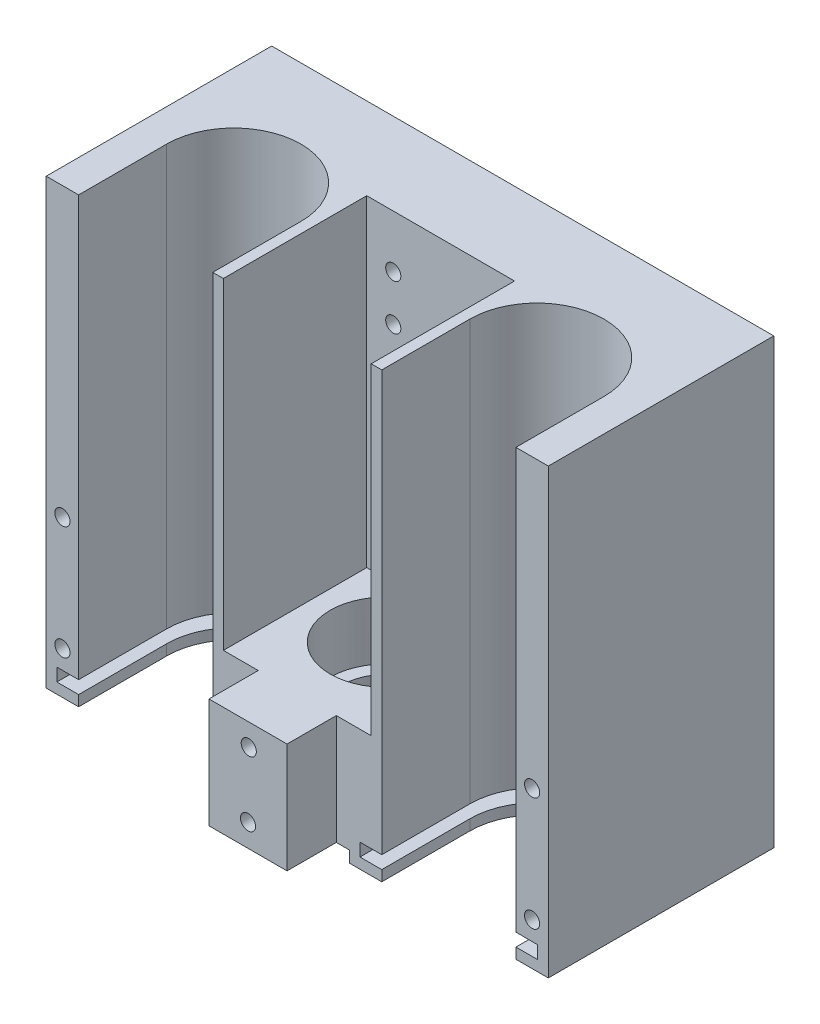
from build123d import *

# Parameters (mm, degrees)
SKETCH1_W                        = 132.5
SKETCH1_H                        = 117
BOSS_EXTRUDE1_DEPTH              = 55.25
CUT_EXTRUDE1_REACH               = 147.364
SKETCH3_W                        = 39
SKETCH3_H                        = 37.83
CUT_EXTRUDE2_DEPTH               = 85
SKETCH4_W                        = 20.6
SKETCH4_H                        = 13
BOSS_EXTRUDE2_DEPTH              = 32
SKETCH5_W                        = 27.5
SKETCH5_H                        = 68.25
CUT_EXTRUDE3_DEPTH               = 3
SKETCH6_W                        = 46.9
SKETCH6_H                        = 3.4
CUT_EXTRUDE4_DEPTH               = 46.9
SKETCH8_R                        = 4.2
SKETCH8_R_2                      = 4.5
CUT_EXTRUDE5_DEPTH               = 14
SKETCH9_R                        = 14.58
CUT_EXTRUDE6_DEPTH               = 15.3
SKETCH10_R                       = 11.2
CUT_EXTRUDE7_DEPTH               = 7.22
BOSS_EXTRUDE3_DEPTH              = 4.25
CUT_EXTRUDE8_REACH               = 116.313
CUT_EXTRUDE8_END_RADIUS          = 4.2
SKETCH15_R                       = 2
F_4_0_MM_DOWEL_HOLES1_D          = 4
F_4_0_MM_DOWEL_HOLES2_AT_2_COUNT = 2
F_4_0_MM_DOWEL_HOLES2_AT_2_PITCH = 30
F_4_0_MM_DOWEL_HOLES3_D          = 4
F_4_0_MM_DOWEL_HOLES3_DEPTH      = 10
F_4_0_MM_DOWEL_HOLES3_TIP        = 1.201721238


with BuildPart() as part:
    # Sketch1 → Boss-Extrude1 (new body)
    with BuildSketch(Plane.XY):
        Rectangle(SKETCH1_W, SKETCH1_H)
    extrude(amount=BOSS_EXTRUDE1_DEPTH)

    # Sketch2 → Cut-Extrude1 (cut, up to next)
    with BuildSketch(Plane(origin=(0, 58.5, 0), x_dir=(1, 0, 0), z_dir=(0, 1, 0)), mode=Mode.PRIVATE) as cut_extrude1_sk1:
        with BuildLine():
            Line((-57.7, -32), (-57.7, -55.25))
            Line((-57.7, -55.25), (-22.3, -55.25))
            Line((-22.3, -55.25), (-22.3, -32))
            ThreePointArc((-22.3, -32), (-40, -14.3), (-57.7, -32))
        make_face()
    cut_extrude1_tool1 = extrude(cut_extrude1_sk1.sketch, amount=-CUT_EXTRUDE1_REACH, mode=Mode.PRIVATE) & part.part
    # Sketch2 → Cut-Extrude1 (cut, up to next)
    with BuildSketch(Plane(origin=(0, 58.5, 0), x_dir=(1, 0, 0), z_dir=(0, 1, 0)), mode=Mode.PRIVATE) as cut_extrude1_sk2:
        with BuildLine():
            Line((57.7, -32), (57.7, -55.25))
            Line((57.7, -55.25), (22.3, -55.25))
            Line((22.3, -55.25), (22.3, -32))
            ThreePointArc((22.3, -32), (40, -14.3), (57.7, -32))
        make_face()
    cut_extrude1_tool2 = extrude(cut_extrude1_sk2.sketch, amount=-CUT_EXTRUDE1_REACH, mode=Mode.PRIVATE) & part.part
    add(cut_extrude1_tool1.solids().sort_by_distance((-40, 58.5, 36.464181))[0], mode=Mode.SUBTRACT)
    add(cut_extrude1_tool2.solids().sort_by_distance((40, 58.5, 36.464181))[0], mode=Mode.SUBTRACT)

    # Sketch3 → Cut-Extrude2 (cut)
    with BuildSketch(Plane(origin=(0, 58.5, 0), x_dir=(1, 0, 0), z_dir=(0, 1, 0))):
        with Locations((0, -36.335)):
            Rectangle(SKETCH3_W, SKETCH3_H)
    extrude(amount=-CUT_EXTRUDE2_DEPTH, mode=Mode.SUBTRACT)

    # Sketch4 → Boss-Extrude2 (add)
    with BuildSketch(Plane(origin=(0, -26.5, 0), x_dir=(1, 0, 0), z_dir=(0, 1, 0))):
        with Locations((0, -61.75)):
            Rectangle(SKETCH4_W, SKETCH4_H)
    extrude(amount=-BOSS_EXTRUDE2_DEPTH)

    # Sketch5 → Cut-Extrude3 (cut)
    with BuildSketch(Plane.XZ.offset(58.5)):
        with Locations((0, 34.125)):
            Rectangle(SKETCH5_W, SKETCH5_H)
    extrude(amount=-CUT_EXTRUDE3_DEPTH, mode=Mode.SUBTRACT)

    # Sketch6 → Cut-Extrude4 (cut)
    with BuildSketch(Plane.XY.offset(55.25)):
        with Locations((-40, -54)):
            Rectangle(SKETCH6_W, SKETCH6_H)
        with Locations((40, -54)):
            Rectangle(SKETCH6_W, SKETCH6_H)
    extrude(amount=-CUT_EXTRUDE4_DEPTH, mode=Mode.SUBTRACT)

    # Sketch8 → Cut-Extrude5 (cut)
    with BuildSketch(Plane.XZ.offset(55.5)):
        with Locations(Location((0, 7, 0), (0, 0, 270))):
            Circle(SKETCH8_R)
        with Locations(Location((0, 57, 0), (0, 0, 270))):
            Circle(SKETCH8_R)
        with Locations(Location((0, 32, 0), (0, 0, 270))):
            Circle(SKETCH8_R_2)
    extrude(amount=-CUT_EXTRUDE5_DEPTH, mode=Mode.SUBTRACT)

    # Sketch9 → Cut-Extrude6 (cut)
    with BuildSketch(Plane(origin=(0, -26.5, 0), x_dir=(1, 0, 0), z_dir=(0, 1, 0))):
        with Locations(Location((0, -32, 0), (0, 0, 270))):
            Circle(SKETCH9_R)
    extrude(amount=-CUT_EXTRUDE6_DEPTH, mode=Mode.SUBTRACT)

    # Sketch10 → Cut-Extrude7 (cut)
    with BuildSketch(Plane(origin=(0, -41.8, 0), x_dir=(1, 0, 0), z_dir=(0, 1, 0))):
        with Locations(Location((0, -32, 0), (0, 0, 270))):
            Circle(SKETCH10_R)
    extrude(amount=-CUT_EXTRUDE7_DEPTH, mode=Mode.SUBTRACT)

    # Sketch12 → Ø3.5 (3.5) Diameter Hole1 (revolve, cut)
    with BuildSketch(Plane(origin=(0, -49.5, 68.25), x_dir=(0, -1, 0), z_dir=(1, 0, 0))):
        Polygon((0, 0), (0, 21.051506083), (1.75, 20), (1.75, 0), align=None)
    f_3_5_3_5_diameter_hole1 = revolve(axis=Axis((0, -49.5, 74.6), (0, 0, -1)), mode=Mode.SUBTRACT)

    # Sketch14 → Boss-Extrude3 (add)
    with BuildSketch(Plane(origin=(0, 0, 0), x_dir=(-1, 0, 0), z_dir=(0, 0, -1))):
        Polygon((-66.25, -58.5), (-13.75, -58.5), (-13.75, -55.5), (13.75, -55.5), (13.75, -58.5), (66.25, -58.5), (66.25, 58.5), (-66.25, 58.5), align=None)
    extrude(amount=BOSS_EXTRUDE3_DEPTH)

    # Cut-Extrude8: up to this cylinder (the profile starts outside it)
    cut_extrude8_end = Plane(origin=(0, -49.5, 57), z_dir=(0, -1, 0)) * Cylinder(CUT_EXTRUDE8_END_RADIUS, 242.026, mode=Mode.PRIVATE)
    # Sketch15 → Cut-Extrude8 (cut, up to the surface)
    with BuildSketch(Plane.XY.offset(68.25), mode=Mode.PRIVATE) as cut_extrude8_sk1:
        with Locations((0, -49.5)):
            Circle(SKETCH15_R)
    cut_extrude8_tool1 = extrude(cut_extrude8_sk1.sketch, amount=-CUT_EXTRUDE8_REACH, mode=Mode.PRIVATE) - cut_extrude8_end
    cut_extrude8 = cut_extrude8_tool1.solids().sort_by_distance((0, -49.5, 68.25))[0]
    add(cut_extrude8, mode=Mode.SUBTRACT)

    # Mirror1: Ø3.5 (3.5) Diameter Hole1, Cut-Extrude8 across plane
    add(f_3_5_3_5_diameter_hole1.mirror(Plane.XY.offset(32)), mode=Mode.SUBTRACT)
    add(cut_extrude8.mirror(Plane.XY.offset(32)), mode=Mode.SUBTRACT)

    # Ø4.0 mm Dowel Holes1 (through all)
    with Locations(Plane.XY.offset(17.42)):
        with Locations((-12.5, 32.58), (12.5, 32.58), (12.5, 44.58), (-12.5, 44.58)):
            Hole(F_4_0_MM_DOWEL_HOLES1_D / 2)

    # Sketch19 → Ø4.0 mm Dowel Holes2 (revolve, cut)
    with BuildSketch(Plane(origin=(61.975, -47.3, 55.25), x_dir=(0, -1, 0), z_dir=(1, 0, 0))):
        Polygon((0, 0), (0, 11.201721238), (2, 10), (2, 0), align=None)
    f_4_0_mm_dowel_holes2 = revolve(axis=Axis((61.975, -47.3, 61.6), (0, 0, -1)), mode=Mode.SUBTRACT)

    # Ø4.0 mm Dowel Holes2 at 2: Ø4.0 mm Dowel Holes2 ×2
    with Locations(*[(0, i * F_4_0_MM_DOWEL_HOLES2_AT_2_PITCH, 0) for i in range(1, F_4_0_MM_DOWEL_HOLES2_AT_2_COUNT)]):
        add(f_4_0_mm_dowel_holes2, mode=Mode.SUBTRACT)

    # Mirror2: Ø4.0 mm Dowel Holes2 across plane
    add(f_4_0_mm_dowel_holes2.mirror(Plane(origin=(0, 0, 0), x_dir=(0, 0, 1), z_dir=(1, 0, 0))), mode=Mode.SUBTRACT)

    # Mirror2 copy 1 sketch → Mirror2 copy 1 (revolve, cut)
    with BuildSketch(Plane(origin=(-61.975, -17.3, 55.25), x_dir=(0, -1, 0), z_dir=(-1, 0, 0))):
        Polygon((0, 0), (0, -11.201721238), (2, -10), (2, 0), align=None)
    revolve(axis=Axis((-61.975, -17.3, 61.6), (0, 0, 1)), mode=Mode.SUBTRACT)

    # Ø4.0 mm Dowel Holes3
    with Locations(Plane.XY.offset(68.25)):
        with Locations((0.2, -32.3)):
            Hole(F_4_0_MM_DOWEL_HOLES3_D / 2, depth=F_4_0_MM_DOWEL_HOLES3_DEPTH)
            with Locations((0, 0, -(F_4_0_MM_DOWEL_HOLES3_DEPTH + F_4_0_MM_DOWEL_HOLES3_TIP / 2))):  # 118° drill point
                Cone(0, F_4_0_MM_DOWEL_HOLES3_D / 2, F_4_0_MM_DOWEL_HOLES3_TIP, mode=Mode.SUBTRACT)


solid = part.part
